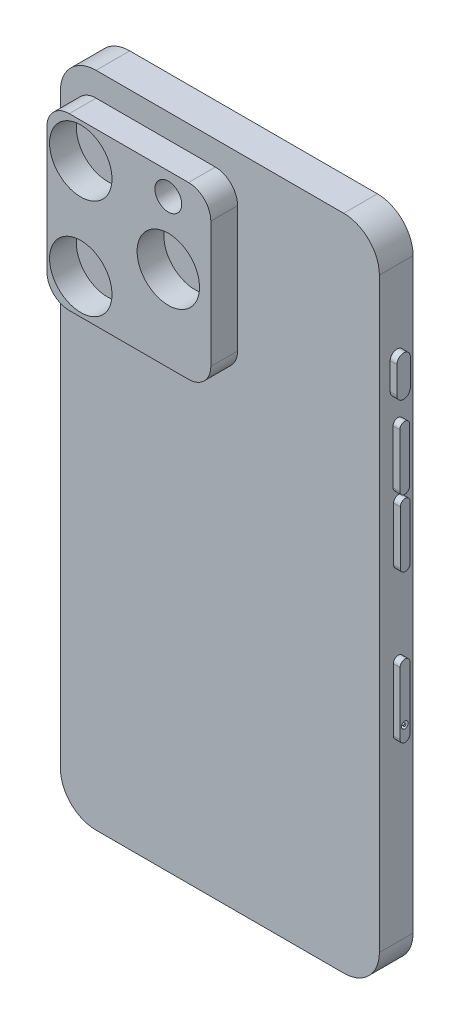
from build123d import *

# Parameters (mm, degrees)
BOSS_EXTRUDE1_DEPTH = 7.55
SKETCH4_R           = 3
SKETCH4_R_2         = 7
BOSS_EXTRUDE2_DEPTH = 6.01
SKETCH5_R           = 3.25
SKETCH5_R_2         = 2.25
CUT_EXTRUDE1_DEPTH  = 0.5
BOSS_EXTRUDE3_DEPTH = 1.15
BOSS_EXTRUDE4_DEPTH = 1.5
BOSS_EXTRUDE5_DEPTH = 1.5
BOSS_EXTRUDE6_DEPTH = 1.5
BOSS_EXTRUDE7_DEPTH = 1.5
SKETCH15_R          = 0.75
SKETCH15_R_2        = 0.282518913
CUT_EXTRUDE2_DEPTH  = 105.40765585
SKETCH16_R          = 1
SKETCH16_R_2        = 0.902700303
SKETCH16_R_3        = 0.840140681
CUT_EXTRUDE3_DEPTH  = 1.5


with BuildPart() as part:
    # Sketch2 → Boss-Extrude1 (new body)
    with BuildSketch(Plane.XY):
        with BuildLine():
            Line((-27.75, 73.75), (27.75, 73.75))
            ThreePointArc((27.75, 73.75), (33.406854249, 71.406854249), (35.75, 65.75))
            Line((35.75, 65.75), (35.75, -65.75))
            ThreePointArc((35.75, -65.75), (33.406854249, -71.406854249), (27.75, -73.75))
            Line((27.75, -73.75), (-27.75, -73.75))
            ThreePointArc((-27.75, -73.75), (-33.406854249, -71.406854249), (-35.75, -65.75))
            Line((-35.75, -65.75), (-35.75, 65.75))
            ThreePointArc((-35.75, 65.75), (-33.406854249, 71.406854249), (-27.75, 73.75))
        make_face()
    extrude(amount=BOSS_EXTRUDE1_DEPTH)

    # Sketch4 → Boss-Extrude2 (add)
    with BuildSketch(Plane.XY.offset(7.55)):
        with BuildLine():
            ThreePointArc((-1.025851878, 68.342271784), (2.509682028, 66.87780569), (3.974148122, 63.342271784))
            Line((3.974148122, 63.342271784), (3.974148122, 35.132271784))
            ThreePointArc((3.974148122, 35.132271784), (2.509682028, 31.596737878), (-1.025851878, 30.132271784))
            Line((-1.025851878, 30.132271784), (-27.755851878, 30.132271784))
            ThreePointArc((-27.755851878, 30.132271784), (-31.291385784, 31.596737878), (-32.755851878, 35.132271784))
            Line((-32.755851878, 35.132271784), (-32.755851878, 63.342271784))
            ThreePointArc((-32.755851878, 63.342271784), (-31.291385784, 66.87780569), (-27.755851878, 68.342271784))
            Line((-27.755851878, 68.342271784), (-1.025851878, 68.342271784))
        make_face()
        with Locations(Location((-5.550757153, 63.342271784, 0), (0, 0, 180))):
            Circle(SKETCH4_R, mode=Mode.SUBTRACT)
        with Locations(Location((-5.550757153, 49.237271784, 0), (0, 0, 180))):
            Circle(SKETCH4_R_2, mode=Mode.SUBTRACT)
        with Locations(Location((-25.170144884, 38.02363754, 0), (0, 0, 180))):
            Circle(SKETCH4_R_2, mode=Mode.SUBTRACT)
        with Locations(Location((-25.170144884, 60.450906027, 0), (0, 0, 180))):
            Circle(SKETCH4_R_2, mode=Mode.SUBTRACT)
    extrude(amount=BOSS_EXTRUDE2_DEPTH)

    # Sketch5 → Cut-Extrude1 (cut)
    # profile 1 of 2: a face of its own
    with BuildSketch(Plane(origin=(0, 0, 0), x_dir=(-1, 0, 0), z_dir=(0, 0, -1))):
        with Locations((8.017760332, 66.917461234)):
            Circle(SKETCH5_R)
        with Locations((8.017760332, 66.917461234)):
            Circle(SKETCH5_R_2, mode=Mode.SUBTRACT)
    # profile 2 of 2: a face of its own
    with BuildSketch(Plane(origin=(0, 0, 0), x_dir=(-1, 0, 0), z_dir=(0, 0, -1))):
        with BuildLine():
            Line((0.126908454, 64.039290859), (-6.373091546, 64.039290859))
            ThreePointArc((-6.373091546, 64.039290859), (-9.251261922, 66.917461234), (-6.373091546, 69.79563161))
            Line((-6.373091546, 69.79563161), (0.126908454, 69.79563161))
            ThreePointArc((0.126908454, 69.79563161), (3.00507883, 66.917461234), (0.126908454, 64.039290859))
        make_face()
        with Locations((0.126908454, 66.917461234)):
            Circle(SKETCH5_R_2, mode=Mode.SUBTRACT)
        with Locations((-6.373091546, 66.917461234)):
            Circle(SKETCH5_R_2, mode=Mode.SUBTRACT)
    extrude(amount=-CUT_EXTRUDE1_DEPTH, mode=Mode.SUBTRACT)

    # Sketch6 → Boss-Extrude3 (add)
    with BuildSketch(Plane.ZY.offset(35.75)):
        with BuildLine():
            Line((1.817009034, 15.75), (1.817009034, 31.75))
            ThreePointArc((1.817009034, 31.75), (3.317009034, 33.25), (4.817009034, 31.75))
            Line((4.817009034, 31.75), (4.817009034, 15.75))
            ThreePointArc((4.817009034, 15.75), (3.317009034, 14.25), (1.817009034, 15.75))
        make_face()
        with BuildLine():
            Line((1.817009034, -31.25), (1.817009034, -11.25))
            ThreePointArc((1.817009034, -11.25), (3.317009034, -9.75), (4.817009034, -11.25))
            Line((4.817009034, -11.25), (4.817009034, -31.25))
            ThreePointArc((4.817009034, -31.25), (3.317009034, -32.75), (1.817009034, -31.25))
        make_face()
    extrude(amount=BOSS_EXTRUDE3_DEPTH)

    # Sketch11 → Boss-Extrude4 (add)
    with BuildSketch(Plane(origin=(35.75, 0, 0), x_dir=(0, 0, -1), z_dir=(1, 0, 0))):
        with BuildLine():
            Line((-2.110967664, 47.91857343), (-2.110967664, 41.91857343))
            ThreePointArc((-2.110967664, 41.91857343), (-3.620147118, 40.409393977), (-5.129326571, 41.91857343))
            Line((-5.129326571, 41.91857343), (-5.129326571, 47.91857343))
            ThreePointArc((-5.129326571, 47.91857343), (-3.620147118, 49.427752884), (-2.110967664, 47.91857343))
        make_face()
    extrude(amount=BOSS_EXTRUDE4_DEPTH)

    # Sketch12 → Boss-Extrude5 (add)
    with BuildSketch(Plane(origin=(35.75, 0, 0), x_dir=(0, 0, -1), z_dir=(1, 0, 0))):
        with BuildLine():
            Line((-2.275343981, 34.931061823), (-2.275343981, 22.931061823))
            ThreePointArc((-2.275343981, 22.931061823), (-3.375343981, 21.831061823), (-4.475343981, 22.931061823))
            Line((-4.475343981, 22.931061823), (-4.475343981, 34.931061823))
            ThreePointArc((-4.475343981, 34.931061823), (-3.375343981, 36.031061823), (-2.275343981, 34.931061823))
        make_face()
    extrude(amount=BOSS_EXTRUDE5_DEPTH)

    # Sketch13 → Boss-Extrude6 (add)
    with BuildSketch(Plane(origin=(35.75, 0, 0), x_dir=(0, 0, -1), z_dir=(1, 0, 0))):
        with BuildLine():
            Line((-2.160495945, 19.909535664), (-2.160495945, 7.909535664))
            ThreePointArc((-2.160495945, 7.909535664), (-3.260495945, 6.809535664), (-4.360495945, 7.909535664))
            Line((-4.360495945, 7.909535664), (-4.360495945, 19.909535664))
            ThreePointArc((-4.360495945, 19.909535664), (-3.260495945, 21.009535664), (-2.160495945, 19.909535664))
        make_face()
    extrude(amount=BOSS_EXTRUDE6_DEPTH)

    # Sketch14 → Boss-Extrude7 (add)
    with BuildSketch(Plane(origin=(35.75, 0, 0), x_dir=(0, 0, -1), z_dir=(1, 0, 0))):
        with BuildLine():
            Line((-2.217009034, -11.25), (-2.217009034, -25.25))
            ThreePointArc((-2.217009034, -25.25), (-3.317009034, -26.35), (-4.417009034, -25.25))
            Line((-4.417009034, -25.25), (-4.417009034, -11.25))
            ThreePointArc((-4.417009034, -11.25), (-3.317009034, -10.15), (-2.217009034, -11.25))
        make_face()
    extrude(amount=BOSS_EXTRUDE7_DEPTH)

    # Sketch15 → Cut-Extrude2 (cut, through all)
    with BuildSketch(Plane(origin=(35.75, 0, 0), x_dir=(0, 0, -1), z_dir=(1, 0, 0))):
        with Locations(Location((-3.338668138, -22.921678058, 0), (0, 0, 90))):
            Circle(SKETCH15_R)
        with Locations(Location((-3.338668138, -22.921678058, 0), (0, 0, 90))):
            Circle(SKETCH15_R_2, mode=Mode.SUBTRACT)
    extrude(amount=CUT_EXTRUDE2_DEPTH, mode=Mode.SUBTRACT)

    # Sketch16 → Cut-Extrude3 (cut)
    # profile 1 of 13: a face of its own
    with BuildSketch(Plane.XZ.offset(73.75)):
        with Locations(Location((-6.64408172, 2.903732575, 0), (0, 0, 270))):
            Circle(SKETCH16_R)
        with Locations(Location((-6.64408172, 2.887582834, 0), (0, 0, 270))):
            Circle(SKETCH16_R_2, mode=Mode.SUBTRACT)
    # profile 2 of 13: a face of its own
    with BuildSketch(Plane.XZ.offset(73.75)):
        with Locations(Location((5.180713546, 2.903732575, 0), (0, 0, 270))):
            Circle(SKETCH16_R)
        with Locations(Location((5.180713546, 2.903732575, 0), (0, 0, 270))):
            Circle(SKETCH16_R_3, mode=Mode.SUBTRACT)
    # profile 3 of 13: a face of its own
    with BuildSketch(Plane.XZ.offset(73.75)):
        with Locations(Location((-12.086230414, 2.887582834, 0), (0, 0, 270))):
            Circle(SKETCH16_R)
    # profile 4 of 13: a face of its own
    with BuildSketch(Plane.XZ.offset(73.75)):
        with Locations(Location((-15.086230414, 2.887582834, 0), (0, 0, 270))):
            Circle(SKETCH16_R)
    # profile 5 of 13: a face of its own
    with BuildSketch(Plane.XZ.offset(73.75)):
        with Locations(Location((-18.086230414, 2.887582834, 0), (0, 0, 270))):
            Circle(SKETCH16_R)
    # profile 6 of 13: a face of its own
    with BuildSketch(Plane.XZ.offset(73.75)):
        with Locations(Location((-21.086230414, 2.887582834, 0), (0, 0, 270))):
            Circle(SKETCH16_R)
    # profile 7 of 13: a face of its own
    with BuildSketch(Plane.XZ.offset(73.75)):
        with Locations(Location((24.787493313, 2.903732575, 0), (0, 0, 270))):
            Circle(SKETCH16_R)
    # profile 8 of 13: a face of its own
    with BuildSketch(Plane.XZ.offset(73.75)):
        with Locations(Location((21.787493313, 2.903732575, 0), (0, 0, 270))):
            Circle(SKETCH16_R)
    # profile 9 of 13: a face of its own
    with BuildSketch(Plane.XZ.offset(73.75)):
        with Locations(Location((18.787493313, 2.903732575, 0), (0, 0, 270))):
            Circle(SKETCH16_R)
    # profile 10 of 13: a face of its own
    with BuildSketch(Plane.XZ.offset(73.75)):
        with Locations(Location((15.787493313, 2.903732575, 0), (0, 0, 270))):
            Circle(SKETCH16_R)
    # profile 11 of 13: a face of its own
    with BuildSketch(Plane.XZ.offset(73.75)):
        with Locations(Location((12.787493313, 2.903732575, 0), (0, 0, 270))):
            Circle(SKETCH16_R)
    # profile 12 of 13: a face of its own
    with BuildSketch(Plane.XZ.offset(73.75)):
        with Locations(Location((9.787493313, 2.903732575, 0), (0, 0, 270))):
            Circle(SKETCH16_R)
    # profile 13 of 13: a face of its own
    with BuildSketch(Plane.XZ.offset(73.75)):
        Polygon((-3.776371679, 3.343279725), (2.223628321, 3.343279725), (3.223628321, 2.343279725), (-4.776371679, 2.343279725), align=None)
    extrude(amount=-CUT_EXTRUDE3_DEPTH, mode=Mode.SUBTRACT)


solid = part.part
